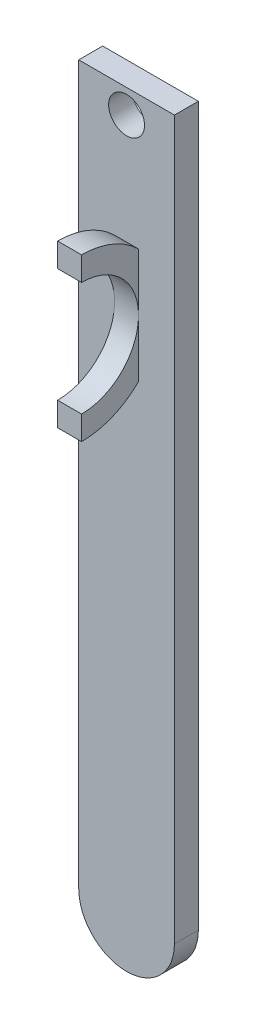
from build123d import *

# Parameters (mm, degrees)
BOSS_EXTRUDE2_DEPTH      = 10
SKETCH2_R                = 7.5
CUT_EXTRUDE2_DEPTH       = 10
ELBOW_MOTOR_HOLDER_DEPTH = 5


with BuildPart() as part:
    # Sketch1 → Boss-Extrude2 (new body)
    with BuildSketch(Plane.XY):
        with BuildLine():
            Line((20, 160), (-20, 160))
            Line((-20, 160), (-20, -140.000000151))
            ThreePointArc((-20, -140.000000151), (7.5e-08, -160), (20, -140))
            Line((20, -140), (20, 160))
        make_face()
    extrude(amount=BOSS_EXTRUDE2_DEPTH)

    # Sketch2 → Cut-Extrude2 (cut)
    with BuildSketch(Plane(origin=(0, 0, 0), x_dir=(-1, 0, 0), z_dir=(0, 0, -1))):
        with Locations((0, 150)):
            Circle(SKETCH2_R)
    extrude(amount=-CUT_EXTRUDE2_DEPTH, mode=Mode.SUBTRACT)

    # Sketch3 → elbow motor holder (add, symmetric)
    with BuildSketch(Plane(origin=(0, 0, 0), x_dir=(0, 0, -1), z_dir=(1, 0, 0))):
        with BuildLine():
            Line((-33.808782217, 113.808782217), (-33.808782217, 103.808782217))
            ThreePointArc((-33.808782217, 103.808782217), (-10, 80), (-33.808782217, 56.191217783))
            Line((-33.808782217, 56.191217783), (-33.808782217, 46.191217783))
            ThreePointArc((-33.808782217, 46.191217783), (0, 80), (-33.808782217, 113.808782217))
        make_face()
    extrude(amount=ELBOW_MOTOR_HOLDER_DEPTH, both=True)


solid = part.part
